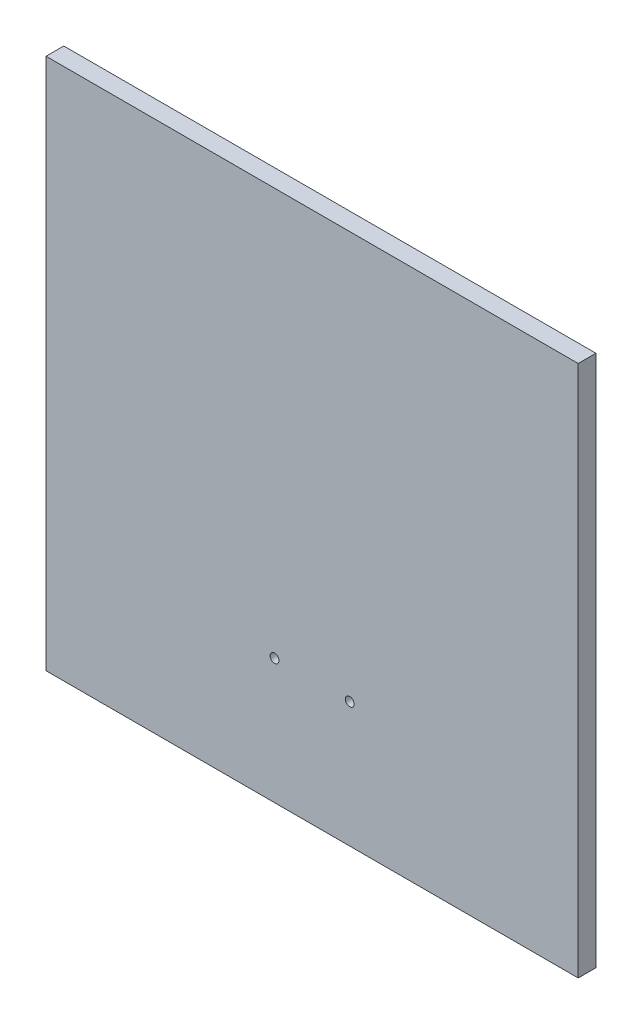
from build123d import *

# Parameters (mm, degrees)
SKETCH1_W           = 300
SKETCH1_H           = 300
SKETCH1_R           = 2.5
BOSS_EXTRUDE1_DEPTH = 10


with BuildPart() as part:
    # Sketch1 → Boss-Extrude1 (new body)
    with BuildSketch(Plane.XY):
        with Locations((42.430278884, -64.541832669)):
            Rectangle(SKETCH1_W, SKETCH1_H)
        with Locations((21.230278884, -144.017203316)):
            Circle(SKETCH1_R, mode=Mode.SUBTRACT)
        with Locations(Location((63.630278884, -144.017203316, 0), (0, 0, 180))):
            Circle(SKETCH1_R, mode=Mode.SUBTRACT)
    extrude(amount=BOSS_EXTRUDE1_DEPTH)


solid = part.part
